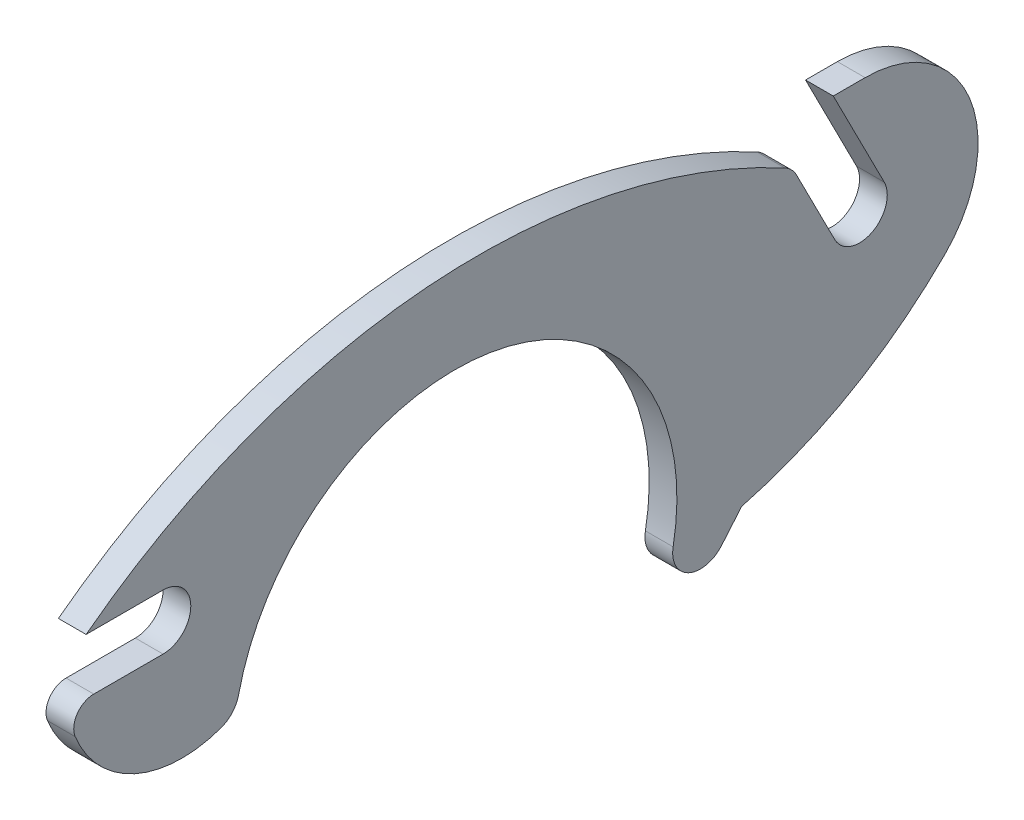
from build123d import *

# Parameters (mm, degrees)
RESSALTO_EXTRUS_O1_DEPTH = 2


with BuildPart() as part:
    # Esboço1 → Ressalto-extrusão1 (new body)
    with BuildSketch(Plane(origin=(0, 0, 0), x_dir=(0, 0, -1), z_dir=(1, 0, 0))):
        with BuildLine():
            Line((47.891048788, 19.389179081), (51.568608211, 12.171562323))
            ThreePointArc((51.568608211, 12.171562323), (50.694576162, 9.481568275), (48.004582114, 10.355600324))
            Line((48.004582114, 10.355600324), (45.23762298, 15.786063389))
            ThreePointArc((45.23762298, 15.786063389), (44.888153026, 16.27331816), (44.409608959, 16.634624175))
            ThreePointArc((44.409608959, 16.634624175), (18.624536688, 22.101585643), (-6, 12.7))
            Line((-6, 12.7), (-0.449608018, 12.7))
            ThreePointArc((-0.449608018, 12.7), (1.550391982, 10.7), (-0.449608018, 8.7))
            Line((-0.449608018, 8.7), (-5.446373062, 8.7))
            ThreePointArc((-5.446373062, 8.7), (-6.646208959, 8.062107753), (-6.788438162, 6.710707165))
            ThreePointArc((-6.788438162, 6.710707165), (-2.477663677, 2.236636341), (3.730763917, 2.001023917))
            ThreePointArc((3.730763917, 2.001023917), (4.55104613, 2.557847644), (5.001705215, 3.440922931))
            ThreePointArc((5.001705215, 3.440922931), (23.834938964, 15.61229456), (36.341556093, -3))
            ThreePointArc((36.341556093, -3), (37.451213604, -5.17490134), (39.837074711, -4.656054149))
            Line((39.837074711, -4.656054149), (41.277742045, -2.945943733))
            ThreePointArc((41.277742045, -2.945943733), (49.179258899, 0.290862483), (55.956453975, 5.485139138))
            ThreePointArc((55.956453975, 5.485139138), (57.714709062, 14.363124933), (50.18816454, 19.389179081))
            Line((50.18816454, 19.389179081), (47.891048788, 19.389179081))
        make_face()
    extrude(amount=RESSALTO_EXTRUS_O1_DEPTH)


solid = part.part
